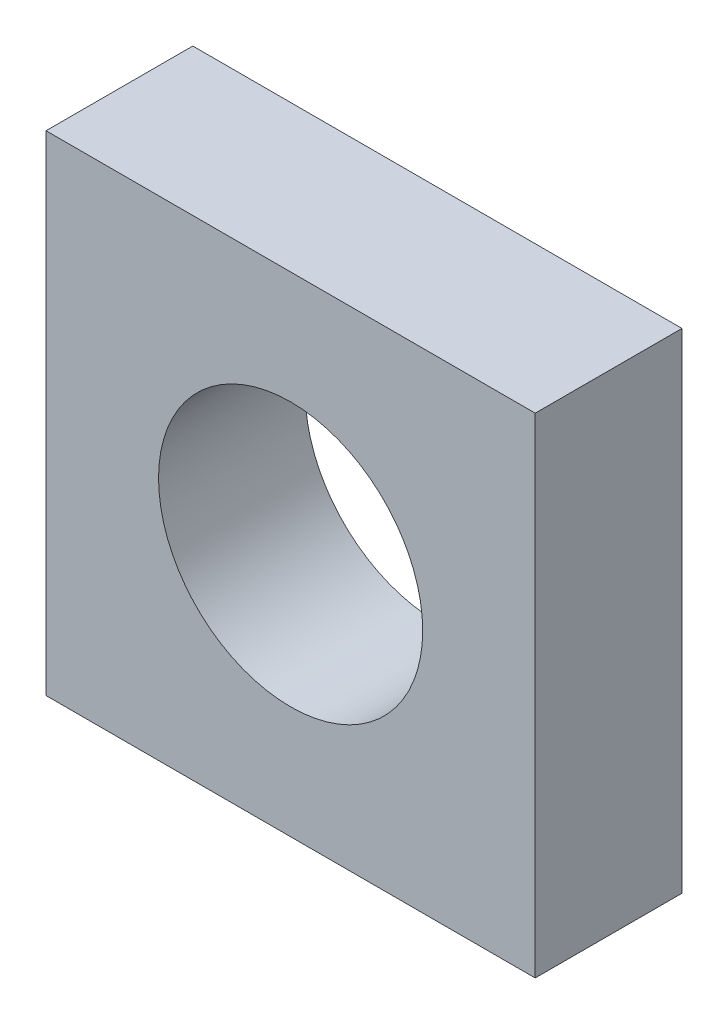
from build123d import *

# Parameters (mm, degrees)
CROQUIS1_W              = 15
CROQUIS1_H              = 15
CROQUIS1_R              = 4.05
SALIENTE_EXTRUIR1_DEPTH = 4.5


with BuildPart() as part:
    # Croquis1 → Saliente-Extruir1 (new body)
    with BuildSketch(Plane.XY):
        Rectangle(CROQUIS1_W, CROQUIS1_H)
        Circle(CROQUIS1_R, mode=Mode.SUBTRACT)
    extrude(amount=SALIENTE_EXTRUIR1_DEPTH)


solid = part.part
